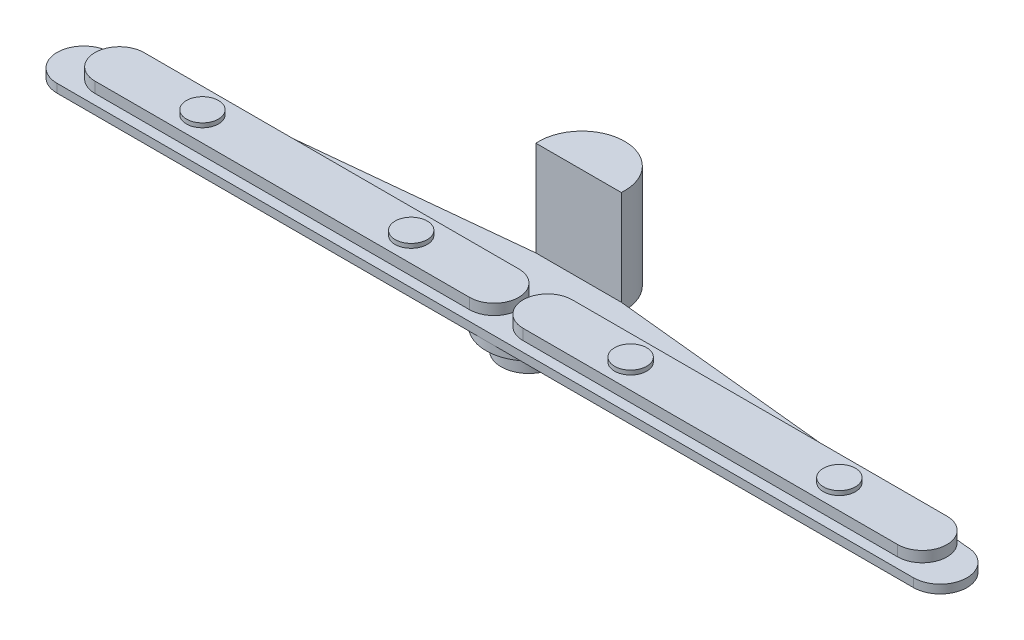
from build123d import *
from build123d.topology import SkipClean

# Parameters (mm, degrees)
BOSS_EXTRUDE1_DEPTH = 40
BOSS_EXTRUDE2_DEPTH = 50
SKETCH3_R           = 75
BOSS_EXTRUDE3_DEPTH = 20
SKETCH4_R           = 200
BOSS_EXTRUDE4_DEPTH = 40
BOSS_EXTRUDE5_DEPTH = 444
SKETCH6_R           = 130
BOSS_EXTRUDE6_DEPTH = 100


with BuildPart() as part:
    # Sketch1 → Boss-Extrude1 (new body)
    with BuildSketch(Plane(origin=(0, 0, 0), x_dir=(1, 0, 0), z_dir=(0, 1, 0))):
        with BuildLine():
            Line((-1446.895354921, -532.23311623), (2553.104645079, -532.23311623))
            ThreePointArc((2553.104645079, -532.23311623), (2678.104643133, -407.21106021), (2553.060533039, -282.233124013))
            Line((2553.060533039, -282.233124013), (756.636813569, -100.229265467))
            ThreePointArc((756.636813569, -100.229265467), (557.196813569, 114.72688377), (357.756813569, -100.229265467))
            Line((357.756813569, -100.229265467), (-1438.639231703, -282.506068524))
            ThreePointArc((-1438.639231703, -282.506068524), (-1571.827098211, -403.102799246), (-1446.895354921, -532.23311623))
        make_face()
    extrude(amount=BOSS_EXTRUDE1_DEPTH)

    # Sketch2 → Boss-Extrude2 (add)
    with BuildSketch(Plane(origin=(0, 40, 0), x_dir=(1, 0, 0), z_dir=(0, 1, 0))):
        with BuildLine():
            Line((682.196813569, -254.73311623), (2432.196813569, -254.73311623))
            ThreePointArc((2432.196813569, -254.73311623), (2547.196813569, -369.73311623), (2432.196813569, -484.73311623))
            Line((2432.196813569, -484.73311623), (682.196813569, -484.73311623))
            ThreePointArc((682.196813569, -484.73311623), (567.196813569, -369.73311623), (682.196813569, -254.73311623))
        make_face()
        with BuildLine():
            Line((432.196813569, -484.73311623), (-1317.803186431, -484.73311623))
            ThreePointArc((-1317.803186431, -484.73311623), (-1432.803186431, -369.73311623), (-1317.803186431, -254.73311623))
            Line((-1317.803186431, -254.73311623), (432.196813569, -254.73311623))
            ThreePointArc((432.196813569, -254.73311623), (547.196813569, -369.73311623), (432.196813569, -484.73311623))
        make_face()
    extrude(amount=BOSS_EXTRUDE2_DEPTH)

    # Sketch3 → Boss-Extrude3 (add)
    with BuildSketch(Plane(origin=(0, 90, 0), x_dir=(1, 0, 0), z_dir=(0, 1, 0))):
        with Locations(Location((-930.303186431, -369.73311623, 0), (0, 0, 270))):
            Circle(SKETCH3_R)
        with Locations(Location((44.696813569, -369.73311623, 0), (0, 0, 270))):
            Circle(SKETCH3_R)
        with Locations(Location((1069.696813569, -369.73311623, 0), (0, 0, 270))):
            Circle(SKETCH3_R)
        with Locations(Location((2044.696813569, -369.73311623, 0), (0, 0, 270))):
            Circle(SKETCH3_R)
    extrude(amount=BOSS_EXTRUDE3_DEPTH)

    # Sketch4 → Boss-Extrude4 (add)
    with BuildSketch(Plane(origin=(0, 0, 0), x_dir=(-1, 0, 0), z_dir=(0, -1, 0))):
        with Locations(Location((-557.196813569, -332.23311623, 0), (0, 0, 270))):
            Circle(SKETCH4_R)
    extrude(amount=BOSS_EXTRUDE4_DEPTH)

    # Sketch5 → Boss-Extrude5 (add)
    with SkipClean():  # the faces are left unmerged after this step: merging them gives an invalid solid
        with BuildSketch(Plane(origin=(0, 40, 0), x_dir=(1, 0, 0), z_dir=(0, 1, 0))):
            with BuildLine():
                Line((756.636813569, -100.229265467), (357.756813569, -100.229265467))
                ThreePointArc((357.756813569, -100.229265467), (557.196813569, 114.72688377), (756.636813569, -100.229265467))
            make_face()
        extrude(amount=BOSS_EXTRUDE5_DEPTH)

    # Sketch6 → Boss-Extrude6 (add)
    with SkipClean():  # the faces are left unmerged after this step: merging them gives an invalid solid
        with BuildSketch(Plane.XZ.offset(40)):
            with Locations(Location((557.196813569, 332.23311623, 0), (0, 0, 90))):
                Circle(SKETCH6_R)
        extrude(amount=BOSS_EXTRUDE6_DEPTH)


solid = part.part
